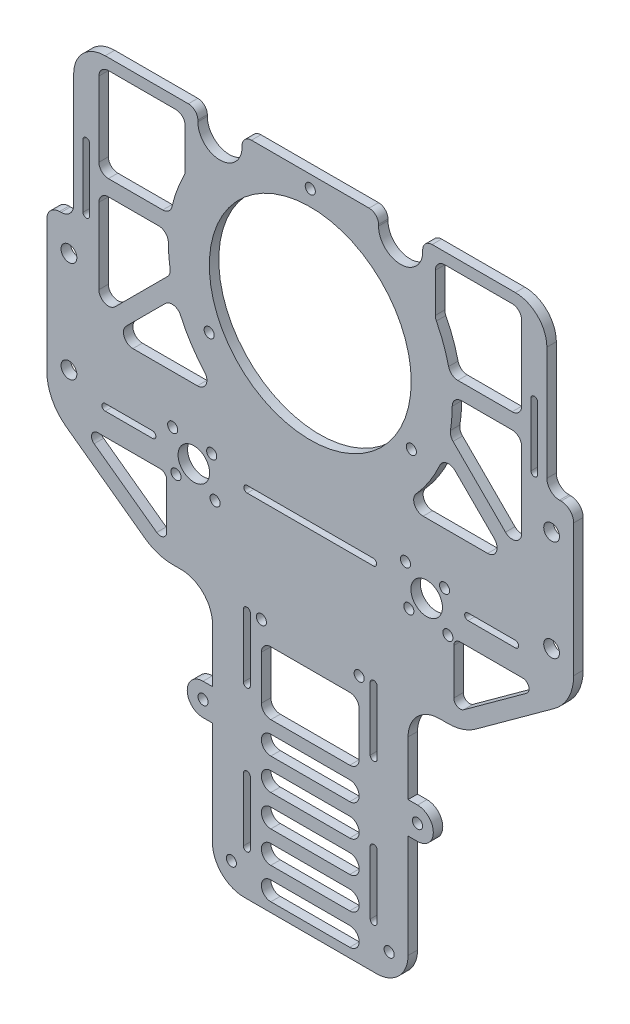
from build123d import *

# Parameters (mm, degrees)
SKETCH_1_R             = 32
SKETCH_1_R_2           = 1.6
EXTRUDE_802_DEPTH      = 3
CUT_EXTRUDE_2450_DEPTH = 3
SKETCH_3_R             = 1.6
CUT_EXTRUDE_2984_DEPTH = 3
CUT_EXTRUDE_3972_DEPTH = 10
SKETCH_6_R             = 2.5
CUT_EXTRUDE_4253_DEPTH = 3
SKETCH_8_R             = 5
SKETCH_8_R_2           = 1.6
CUT_EXTRUDE_4669_DEPTH = 3
FILLET_1_R             = 10
FILLET_2_R             = 15
FILLET_4_R             = 3
CUT_EXTRUDE_7756_DEPTH = 3
SKETCH_10_R            = 1.6
CUT_EXTRUDE_8082_DEPTH = 3
FILLET_5_R             = 4
CUT_EXTRUDE_1_DEPTH    = 188.630621168
SKETCH_12_W            = 150
SKETCH_12_H            = 60.94538579
CUT_EXTRUDE_2_DEPTH    = 10
FILLET_6_R             = 15
FILLET_7_R             = 10
FILLET_8_R             = 3
CUT_EXTRUDE_3_DEPTH    = 188.630621168
FILLET_9_R             = 2


with BuildPart() as part:
    # 草图1 → Extrude 802 (new body)
    with BuildSketch(Plane.XY):
        with BuildLine():
            Line((-39.5, 92.55), (39.5, 92.55))
            Line((39.5, 92.55), (75, 72.054065444))
            Line((75, 72.054065444), (75, -9))
            Line((75, -9), (83.5, -9))
            Line((83.5, -9), (83.5, -88))
            Line((83.5, -88), (31, -88))
            Line((31, -88), (31, -115.2))
            Line((31, -115.2), (34, -115.2))
            ThreePointArc((34, -115.2), (39, -120.2), (34, -125.2))
            Line((34, -125.2), (31, -125.2))
            Line((31, -125.2), (31, -168))
            Line((31, -168), (-31, -168))
            Line((-31, -168), (-31, -125.2))
            Line((-31, -125.2), (-34, -125.2))
            ThreePointArc((-34, -125.2), (-39, -120.2), (-34, -115.2))
            Line((-34, -115.2), (-31, -115.2))
            Line((-31, -115.2), (-31, -88))
            Line((-31, -88), (-83.5, -88))
            Line((-83.5, -88), (-83.5, -9))
            Line((-83.5, -9), (-75, -9))
            Line((-75, -9), (-75, 72.054065444))
            Line((-75, 72.054065444), (-39.5, 92.55))
        make_face()
        Circle(SKETCH_1_R, mode=Mode.SUBTRACT)
        with Locations((-34, -120.2)):
            Circle(SKETCH_1_R_2, mode=Mode.SUBTRACT)
        with Locations((34, -120.2)):
            Circle(SKETCH_1_R_2, mode=Mode.SUBTRACT)
    extrude(amount=EXTRUDE_802_DEPTH)

    # 草图2 → Cut-Extrude 2450 (cut)
    with BuildSketch(Plane.XY.offset(3)):
        with BuildLine():
            Line((-12.5, -159), (12.5, -159))
            ThreePointArc((12.5, -159), (15.5, -162), (12.5, -165))
            Line((12.5, -165), (-12.5, -165))
            ThreePointArc((-12.5, -165), (-15.5, -162), (-12.5, -159))
        make_face()
        with BuildLine():
            Line((-12.5, -149), (12.5, -149))
            ThreePointArc((12.5, -149), (15.5, -152), (12.5, -155))
            Line((12.5, -155), (-12.5, -155))
            ThreePointArc((-12.5, -155), (-15.5, -152), (-12.5, -149))
        make_face()
        with BuildLine():
            Line((-12.5, -139), (12.5, -139))
            ThreePointArc((12.5, -139), (15.5, -142), (12.5, -145))
            Line((12.5, -145), (-12.5, -145))
            ThreePointArc((-12.5, -145), (-15.5, -142), (-12.5, -139))
        make_face()
        with BuildLine():
            Line((-12.5, -129), (12.5, -129))
            ThreePointArc((12.5, -129), (15.5, -132), (12.5, -135))
            Line((12.5, -135), (-12.5, -135))
            ThreePointArc((-12.5, -135), (-15.5, -132), (-12.5, -129))
        make_face()
        with BuildLine():
            Line((-12.5, -119), (12.5, -119))
            ThreePointArc((12.5, -119), (15.5, -122), (12.5, -125))
            Line((12.5, -125), (-12.5, -125))
            ThreePointArc((-12.5, -125), (-15.5, -122), (-12.5, -119))
        make_face()
        with BuildLine():
            Line((-12.5, -115), (12.5, -115))
            ThreePointArc((12.5, -115), (14.621320344, -114.121320344), (15.5, -112))
            Line((15.5, -112), (15.5, -98))
            ThreePointArc((15.5, -98), (14.621320344, -95.878679656), (12.5, -95))
            Line((12.5, -95), (-12.5, -95))
            ThreePointArc((-12.5, -95), (-14.621320344, -95.878679656), (-15.5, -98))
            Line((-15.5, -98), (-15.5, -112))
            ThreePointArc((-15.5, -112), (-14.621320344, -114.121320344), (-12.5, -115))
        make_face()
        Polygon((-67, 42.43526329), (-39.64, 42.43526329), (-39.64, 83.231566655), (-67, 67.43526329), align=None)
        with BuildLine():
            Line((-67, 37.43526329), (-39.64, 37.43526329))
            Line((-39.64, 37.43526329), (-39.64, 21.299539901))
            ThreePointArc((-39.64, 21.299539901), (-42.522710224, 14.724778952), (-44.32319123, 7.77526329))
            Line((-44.32319123, 7.77526329), (-67, 7.77526329))
            Line((-67, 7.77526329), (-67, 37.43526329))
        make_face()
        with BuildLine():
            Line((-67, 2.77526329), (-44.914339733, 2.77526329))
            ThreePointArc((-44.914339733, 2.77526329), (-44.903140873, -2.950921841), (-44.164858791, -8.629324885))
            Line((-44.164858791, -8.629324885), (-67, -31.464466094))
            Line((-67, -31.464466094), (-67, 2.77526329))
        make_face()
        with BuildLine():
            Line((-63.464466094, -35), (-42.691740114, -14.22727402))
            ThreePointArc((-42.691740114, -14.22727402), (-36.976682969, -25.646148183), (-28.284271247, -35))
            Line((-28.284271247, -35), (-63.464466094, -35))
        make_face()
        with BuildLine():
            Line((28.284271247, -35), (63.464466094, -35))
            Line((63.464466094, -35), (42.691740114, -14.22727402))
            ThreePointArc((42.691740114, -14.22727402), (36.976682969, -25.646148183), (28.284271247, -35))
        make_face()
        with BuildLine():
            Line((67, -31.464466094), (67, 2.77526329))
            Line((67, 2.77526329), (44.914339733, 2.77526329))
            ThreePointArc((44.914339733, 2.77526329), (44.903140873, -2.950921841), (44.164858791, -8.629324885))
            Line((44.164858791, -8.629324885), (67, -31.464466094))
        make_face()
        with BuildLine():
            Line((67, 7.77526329), (44.32319123, 7.77526329))
            ThreePointArc((44.32319123, 7.77526329), (42.522710224, 14.724778952), (39.64, 21.299539901))
            Line((39.64, 21.299539901), (39.64, 37.43526329))
            Line((39.64, 37.43526329), (67, 37.43526329))
            Line((67, 37.43526329), (67, 7.77526329))
        make_face()
        with BuildLine():
            Line((-21.64, 75.55), (-21.64, 37.55))
            ThreePointArc((-21.64, 37.55), (-28.64, 30.55), (-35.64, 37.55))
            Line((-35.64, 37.55), (-35.64, 75.55))
            ThreePointArc((-35.64, 75.55), (-28.64, 82.55), (-21.64, 75.55))
        make_face()
        with BuildLine():
            Line((-2.64, 75.55), (-2.64, 44.922493252))
            ThreePointArc((-2.64, 44.922493252), (-9.764776764, 43.927771794), (-16.64, 41.810410187))
            Line((-16.64, 41.810410187), (-16.64, 75.55))
            ThreePointArc((-16.64, 75.55), (-9.64, 82.55), (-2.64, 75.55))
        make_face()
        Polygon((67, 42.43526329), (39.64, 42.43526329), (39.64, 83.231566655), (67, 67.43526329), align=None)
        with BuildLine():
            Line((21.64, 75.55), (21.64, 37.55))
            ThreePointArc((21.64, 37.55), (28.64, 30.55), (35.64, 37.55))
            Line((35.64, 37.55), (35.64, 75.55))
            ThreePointArc((35.64, 75.55), (28.64, 82.55), (21.64, 75.55))
        make_face()
        with BuildLine():
            Line((2.64, 75.55), (2.64, 44.922493252))
            ThreePointArc((2.64, 44.922493252), (9.764776764, 43.927771794), (16.64, 41.810410187))
            Line((16.64, 41.810410187), (16.64, 75.55))
            ThreePointArc((16.64, 75.55), (9.64, 82.55), (2.64, 75.55))
        make_face()
    extrude(amount=-CUT_EXTRUDE_2450_DEPTH, mode=Mode.SUBTRACT)

    # 草图3 → Cut-Extrude 2984 (cut)
    with BuildSketch(Plane.XY.offset(3)):
        with Locations((0, 37)):
            Circle(SKETCH_3_R)
        with Locations((32.04293994, -18.5)):
            Circle(SKETCH_3_R)
        with Locations((-32.04293994, -18.5)):
            Circle(SKETCH_3_R)
        with Locations((-15.5, -89)):
            Circle(SKETCH_3_R)
        with Locations((15.5, -89)):
            Circle(SKETCH_3_R)
    extrude(amount=-CUT_EXTRUDE_2984_DEPTH, mode=Mode.SUBTRACT)

    # 草图5 → Cut-Extrude 3972 (cut)
    with BuildSketch(Plane.XY.offset(3)):
        with BuildLine():
            Line((-27.5, 86.14), (27.5, 86.14))
            ThreePointArc((27.5, 86.14), (28.55, 85.09), (27.5, 84.04))
            Line((27.5, 84.04), (-27.5, 84.04))
            ThreePointArc((-27.5, 84.04), (-28.55, 85.09), (-27.5, 86.14))
        make_face()
        with BuildLine():
            Line((72.05, 14.5), (72.05, -5.5))
            ThreePointArc((72.05, -5.5), (71, -6.55), (69.95, -5.5))
            Line((69.95, -5.5), (69.95, 14.5))
            ThreePointArc((69.95, 14.5), (71, 15.55), (72.05, 14.5))
        make_face()
        with BuildLine():
            Line((72.05, 64.5), (72.05, 44.5))
            ThreePointArc((72.05, 44.5), (71, 43.45), (69.95, 44.5))
            Line((69.95, 44.5), (69.95, 64.5))
            ThreePointArc((69.95, 64.5), (71, 65.55), (72.05, 64.5))
        make_face()
        with BuildLine():
            Line((50, -54.45), (65, -54.45))
            ThreePointArc((65, -54.45), (66.05, -55.5), (65, -56.55))
            Line((65, -56.55), (50, -56.55))
            ThreePointArc((50, -56.55), (48.95, -55.5), (50, -54.45))
        make_face()
        with BuildLine():
            Line((-72.05, 64.5), (-72.05, 44.5))
            ThreePointArc((-72.05, 44.5), (-71, 43.45), (-69.95, 44.5))
            Line((-69.95, 44.5), (-69.95, 64.5))
            ThreePointArc((-69.95, 64.5), (-71, 65.55), (-72.05, 64.5))
        make_face()
        with BuildLine():
            Line((-72.05, 14.5), (-72.05, -5.5))
            ThreePointArc((-72.05, -5.5), (-71, -6.55), (-69.95, -5.5))
            Line((-69.95, -5.5), (-69.95, 14.5))
            ThreePointArc((-69.95, 14.5), (-71, 15.55), (-72.05, 14.5))
        make_face()
        with BuildLine():
            Line((-50, -54.45), (-65, -54.45))
            ThreePointArc((-65, -54.45), (-66.05, -55.5), (-65, -56.55))
            Line((-65, -56.55), (-50, -56.55))
            ThreePointArc((-50, -56.55), (-48.95, -55.5), (-50, -54.45))
        make_face()
        with BuildLine():
            Line((-20, -54.45), (20, -54.45))
            ThreePointArc((20, -54.45), (21.05, -55.5), (20, -56.55))
            Line((20, -56.55), (-20, -56.55))
            ThreePointArc((-20, -56.55), (-21.05, -55.5), (-20, -54.45))
        make_face()
    extrude(amount=-CUT_EXTRUDE_3972_DEPTH, mode=Mode.SUBTRACT)

    # 草图6 → Cut-Extrude 4253 (cut)
    with BuildSketch(Plane.XY.offset(3)):
        with Locations((-76.5, -19)):
            Circle(SKETCH_6_R)
        with Locations((-76.5, -51)):
            Circle(SKETCH_6_R)
        with Locations(Location((76.5, -19, 0), (0, 0, 180))):
            Circle(SKETCH_6_R)
        with Locations(Location((76.5, -51, 0), (0, 0, 180))):
            Circle(SKETCH_6_R)
    extrude(amount=-CUT_EXTRUDE_4253_DEPTH, mode=Mode.SUBTRACT)

    # 草图8 → Cut-Extrude 4669 (cut)
    with BuildSketch(Plane.XY.offset(3)):
        with Locations((36.9, -57)):
            Circle(SKETCH_8_R)
        with Locations((42.556854249, -51.343145751)):
            Circle(SKETCH_8_R_2)
        with Locations((31.243145751, -62.656854249)):
            Circle(SKETCH_8_R_2)
        with Locations((30.182485579, -50.282485579)):
            Circle(SKETCH_8_R_2)
        with Locations((43.617514421, -63.717514421)):
            Circle(SKETCH_8_R_2)
        with Locations((-43.617514421, -50.282485579)):
            Circle(SKETCH_8_R_2)
        with Locations((-36.9, -57)):
            Circle(SKETCH_8_R)
        with Locations((-42.556854249, -62.656854249)):
            Circle(SKETCH_8_R_2)
        with Locations((-30.182485579, -63.717514421)):
            Circle(SKETCH_8_R_2)
        with Locations((-31.243145751, -51.343145751)):
            Circle(SKETCH_8_R_2)
    extrude(amount=-CUT_EXTRUDE_4669_DEPTH, mode=Mode.SUBTRACT)

    # 圆角1
    fillet_1_edges = [part.edges().sort_by_distance(p)[0] for p in [
        (83.5, -88, 1.5),
        (31, -88, 1.5),
        (31, -168, 1.5),
        (-31, -168, 1.5),
        (-31, -88, 1.5),
        (-83.5, -88, 1.5),
    ]]
    fillet(fillet_1_edges, radius=FILLET_1_R)

    # 圆角2
    fillet_2_edges = [part.edges().sort_by_distance(p)[0] for p in [
        (-39.5, 92.55, 1.5),
        (39.5, 92.55, 1.5),
        (75, 72.054065444, 1.5),
        (-75, 72.054065444, 1.5),
    ]]
    fillet(fillet_2_edges, radius=FILLET_2_R)

    # 圆角4
    fillet_4_edges = [part.edges().sort_by_distance(p)[0] for p in [
        (-2.64, 44.922493252, 1.5),
        (-16.64, 41.810410187, 1.5),
        (-67, -31.464466094, 1.5),
        (-67, 2.77526329, 1.5),
        (-44.914339733, 2.77526329, 1.5),
        (-44.164858791, -8.629324885, 1.5),
        (28.284271247, -35, 1.5),
        (42.691740114, -14.22727402, 1.5),
        (63.464466094, -35, 1.5),
        (16.64, 41.810410187, 1.5),
        (2.64, 44.922493252, 1.5),
        (67, 67.43526329, 1.5),
        (67, 42.43526329, 1.5),
        (39.64, 42.43526329, 1.5),
        (39.64, 83.231566655, 1.5),
        (67, 37.43526329, 1.5),
        (67, 7.77526329, 1.5),
        (44.32319123, 7.77526329, 1.5),
        (39.64, 21.299539901, 1.5),
        (39.64, 37.43526329, 1.5),
        (67, -31.464466094, 1.5),
        (44.164858791, -8.629324885, 1.5),
        (44.914339733, 2.77526329, 1.5),
        (67, 2.77526329, 1.5),
        (-67, 67.43526329, 1.5),
        (-39.64, 83.231566655, 1.5),
        (-39.64, 42.43526329, 1.5),
        (-67, 42.43526329, 1.5),
        (-42.691740114, -14.22727402, 1.5),
        (-28.284271247, -35, 1.5),
        (-63.464466094, -35, 1.5),
        (-39.64, 21.299539901, 1.5),
        (-44.32319123, 7.77526329, 1.5),
        (-67, 7.77526329, 1.5),
        (-67, 37.43526329, 1.5),
        (-39.64, 37.43526329, 1.5),
    ]]
    fillet(fillet_4_edges, radius=FILLET_4_R)

    # 草图9 → Cut-Extrude 7756 (cut)
    with BuildSketch(Plane.XY.offset(3)):
        with BuildLine():
            Line((21.2, -89), (21.2, -109))
            ThreePointArc((21.2, -109), (20.1, -110.1), (19, -109))
            Line((19, -109), (19, -89))
            ThreePointArc((19, -89), (20.1, -87.9), (21.2, -89))
        make_face()
        with BuildLine():
            Line((21.2, -134), (21.2, -154))
            ThreePointArc((21.2, -154), (20.1, -155.1), (19, -154))
            Line((19, -154), (19, -134))
            ThreePointArc((19, -134), (20.1, -132.9), (21.2, -134))
        make_face()
        with BuildLine():
            Line((-21.2, -134), (-21.2, -154))
            ThreePointArc((-21.2, -154), (-20.1, -155.1), (-19, -154))
            Line((-19, -154), (-19, -134))
            ThreePointArc((-19, -134), (-20.1, -132.9), (-21.2, -134))
        make_face()
        with BuildLine():
            Line((-21.2, -89), (-21.2, -109))
            ThreePointArc((-21.2, -109), (-20.1, -110.1), (-19, -109))
            Line((-19, -109), (-19, -89))
            ThreePointArc((-19, -89), (-20.1, -87.9), (-21.2, -89))
        make_face()
    extrude(amount=-CUT_EXTRUDE_7756_DEPTH, mode=Mode.SUBTRACT)

    # 草图10 → Cut-Extrude 8082 (cut)
    with BuildSketch(Plane.XY.offset(3)):
        with Locations((25, -160)):
            Circle(SKETCH_10_R)
        with Locations((-25, -160)):
            Circle(SKETCH_10_R)
    extrude(amount=-CUT_EXTRUDE_8082_DEPTH, mode=Mode.SUBTRACT)

    # 圆角5
    fillet_5_edges = [part.edges().sort_by_distance(p)[0] for p in [
        (75, -9, 1.5),
        (83.5, -9, 1.5),
        (-83.5, -9, 1.5),
        (-75, -9, 1.5),
    ]]
    fillet(fillet_5_edges, radius=FILLET_5_R)

    # 草图11 → 切除-拉伸1 (cut, through all)
    with BuildSketch(Plane.XY.offset(3)):
        Polygon((48.5, -88), (83.5, -62.57101152), (83.5, -88), align=None)
        Polygon((-83.5, -88), (-48.5, -88), (-83.5, -62.57101152), align=None)
    extrude(amount=-CUT_EXTRUDE_1_DEPTH, mode=Mode.SUBTRACT)

    # 草图12 → 切除-拉伸2 (cut)
    with BuildSketch(Plane.XY.offset(3)):
        with Locations((0, 71.472692895)):
            Rectangle(SKETCH_12_W, SKETCH_12_H)
    extrude(amount=-CUT_EXTRUDE_2_DEPTH, mode=Mode.SUBTRACT)

    # 圆角6
    fillet_6_edges = [part.edges().sort_by_distance(p)[0] for p in [
        (48.5, -88, 1.5),
        (83.5, -62.57101152, 1.5),
        (-83.5, -62.57101152, 1.5),
        (-48.5, -88, 1.5),
    ]]
    fillet(fillet_6_edges, radius=FILLET_6_R)

    # 圆角7
    fillet_7_edges = [part.edges().sort_by_distance(p)[0] for p in [
        (75, 41, 1.5),
        (-75, 41, 1.5),
    ]]
    fillet(fillet_7_edges, radius=FILLET_7_R)

    # 圆角8
    fillet_8_edges = [part.edges().sort_by_distance(p)[0] for p in [
        (-35.64, 41, 1.5),
        (21.64, 41, 1.5),
        (-21.64, 41, 1.5),
        (35.64, 41, 1.5),
    ]]
    fillet(fillet_8_edges, radius=FILLET_8_R)

    # 草图13 → 切除-拉伸3 (cut, through all)
    with BuildSketch(Plane(origin=(0, 0, 0), x_dir=(-1, 0, 0), z_dir=(0, 0, -1))):
        Polygon((45.5, -83.999287697), (73.5, -63.656096912), (45.5, -63.656096912), align=None)
        Polygon((-45.5, -63.656096912), (-45.5, -83.999287697), (-73.5, -63.656096912), align=None)
    extrude(amount=-CUT_EXTRUDE_3_DEPTH, mode=Mode.SUBTRACT)

    # 圆角9
    fillet_9_edges = [part.edges().sort_by_distance(p)[0] for p in [
        (-45.5, -83.999287697, 1.5),
        (-45.5, -63.656096912, 1.5),
        (-73.5, -63.656096912, 1.5),
        (73.5, -63.656096912, 1.5),
        (45.5, -63.656096912, 1.5),
        (45.5, -83.999287697, 1.5),
    ]]
    fillet(fillet_9_edges, radius=FILLET_9_R)


solid = part.part
